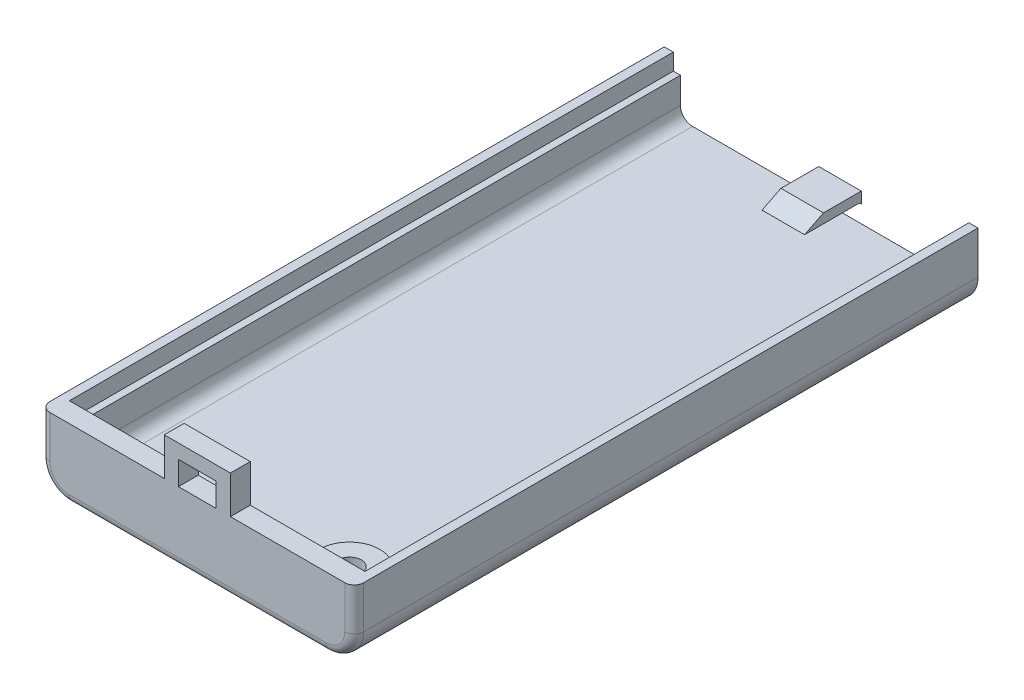
from build123d import *

# Parameters (mm, degrees)
EXTRU_MINCE1_DEPTH             = 32
EXTRU_MINCE1_DEPTH_BACK        = 32
BOSS_EXTRU_1_DEPTH             = 2
BOSS_EXTRU_1_DEPTH_BACK        = 0.1
ESQUISSE2_W                    = 4
ESQUISSE2_H                    = 2.5
ESQUISSE3_W                    = 31.28
ESQUISSE3_H                    = 65.9
ENL_V_MAT_EXTRU_4_DEPTH        = 1.75
ESQUISSE4_W                    = 4.5
ESQUISSE4_H                    = 6
BOSS_EXTRU_2_DEPTH             = 1
BOSS_EXTRU_3_REACH             = 40.572
BOSS_EXTRU_3_DIRECTION_2_REACH = 40.572
ENL_V_MAT_EXTRU_5_REACH        = 41.593
ESQUISSE7_W                    = 6.5
ESQUISSE7_H                    = 0.2
ESQUISSE7_W_2                  = 5.666666666
ESQUISSE7_W_3                  = 4.833333334
ESQUISSE7_W_4                  = 4
EXTRU_MINCE2_DEPTH             = 0.2
ESQUISSE8_R                    = 2.5
ENL_V_MAT_EXTRU_6_DEPTH        = 40.545037615
ESQUISSE9_R                    = 3.2
ESQUISSE9_R_2                  = 1.25
BOSS_EXTRU_4_DEPTH             = 1
CONG_1_R                       = 1


with BuildPart() as part:
    # Esquisse1 → Extru.-Mince1 (new, two sides: drawn at the far end of the back side and taken through both)
    with BuildSketch(Plane.XY.offset(-EXTRU_MINCE1_DEPTH_BACK)):
        with BuildLine():
            Line((-16.6, 0), (-16.6, -4.5))
            ThreePointArc((-16.6, -4.5), (-15.721320344, -6.621320344), (-13.6, -7.5))
            Line((-13.6, -7.5), (13.6, -7.5))
            ThreePointArc((13.6, -7.5), (15.721320344, -6.621320344), (16.6, -4.5))
            Line((16.6, -4.5), (16.6, 0))
            Line((16.6, 0), (14.89, 0))
            Line((14.89, 0), (14.89, -4.5))
            ThreePointArc((14.89, -4.5), (14.512167748, -5.412167748), (13.6, -5.79))
            Line((13.6, -5.79), (-13.6, -5.79))
            ThreePointArc((-13.6, -5.79), (-14.512167748, -5.412167748), (-14.89, -4.5))
            Line((-14.89, -4.5), (-14.89, 0))
            Line((-14.89, 0), (-16.6, 0))
        make_face()
    extrude(amount=EXTRU_MINCE1_DEPTH + EXTRU_MINCE1_DEPTH_BACK)

    # Esquisse2 → Boss.-Extru.1 (add, two sides: drawn at the far end of the back side and taken through both)
    with BuildSketch(Plane.XY.offset(32).offset(-BOSS_EXTRU_1_DEPTH_BACK)):
        with BuildLine():
            Line((16.6, -4.5), (16.6, 0))
            Line((16.6, 0), (3.5, 0))
            Line((3.5, 0), (3.5, 4))
            Line((3.5, 4), (-3.5, 4))
            Line((-3.5, 4), (-3.5, 0))
            Line((-3.5, 0), (-16.6, 0))
            Line((-16.6, 0), (-16.6, -4.5))
            ThreePointArc((-16.6, -4.5), (-15.721320344, -6.621320344), (-13.6, -7.5))
            Line((-13.6, -7.5), (13.6, -7.5))
            ThreePointArc((13.6, -7.5), (15.721320344, -6.621320344), (16.6, -4.5))
        make_face()
        with Locations((0, 1.25)):
            Rectangle(ESQUISSE2_W, ESQUISSE2_H, mode=Mode.SUBTRACT)
    extrude(amount=BOSS_EXTRU_1_DEPTH + BOSS_EXTRU_1_DEPTH_BACK)

    # Esquisse3 → Enlèv. mat.-Extru.4 (cut)
    with BuildSketch(Plane(origin=(0, 0, 0), x_dir=(1, 0, 0), z_dir=(0, 1, 0))):
        with Locations((0, 1.05)):
            Rectangle(ESQUISSE3_W, ESQUISSE3_H)
    extrude(amount=-ENL_V_MAT_EXTRU_4_DEPTH, mode=Mode.SUBTRACT)

    # Esquisse4 → Boss.-Extru.2 (add)
    with BuildSketch(Plane(origin=(0, -5.79, 0), x_dir=(1, 0, 0), z_dir=(0, 1, 0))):
        with Locations((0, 31)):
            Rectangle(ESQUISSE4_W, ESQUISSE4_H)
    extrude(amount=BOSS_EXTRU_2_DEPTH)

    # Boss.-Extru.3: up to this face of the body (flat: up to its plane)
    boss_extru_3_end = Plane(part.part.faces().sort_by_distance((2.25, -5.29, -31))[0])
    # Esquisse5 → Boss.-Extru.3 (add, up to the picked face)
    with BuildSketch(Plane(origin=(0, 0, 0), x_dir=(0, 0, -1), z_dir=(1, 0, 0)), mode=Mode.PRIVATE) as boss_extru_3_sk1:
        Polygon((34, -5.79), (34, -5.99), (33.8, -5.79), align=None)
    boss_extru_3_tool1 = split(extrude(boss_extru_3_sk1.sketch, amount=BOSS_EXTRU_3_REACH, mode=Mode.PRIVATE), bisect_by=boss_extru_3_end, keep=Keep.BOTH, mode=Mode.PRIVATE)
    add(boss_extru_3_tool1.solids().sort_by(Axis((0, -5.856667, -33.933333), (1, 0, 0)))[0])

    # Boss.-Extru.3 direction 2: up to this face of the body (flat: up to its plane)
    boss_extru_3_direction_2_end = Plane(part.part.faces().sort_by_distance((-2.25, -5.29, -31))[0])
    # Esquisse5 → Boss.-Extru.3 direction 2 (add, up to the picked face)
    with BuildSketch(Plane(origin=(0, 0, 0), x_dir=(0, 0, -1), z_dir=(1, 0, 0)), mode=Mode.PRIVATE) as boss_extru_3_direction_2_sk1:
        Polygon((34, -5.79), (34, -5.99), (33.8, -5.79), align=None)
    boss_extru_3_direction_2_tool1 = split(extrude(boss_extru_3_direction_2_sk1.sketch, amount=-BOSS_EXTRU_3_DIRECTION_2_REACH, mode=Mode.PRIVATE), bisect_by=boss_extru_3_direction_2_end, keep=Keep.BOTH, mode=Mode.PRIVATE)
    add(boss_extru_3_direction_2_tool1.solids().sort_by(Axis((0, -5.856667, -33.933333), (-1, 0, 0)))[0])

    # Esquisse6 → Enlèv. mat.-Extru.5 (cut, up to next)
    with BuildSketch(Plane(origin=(2.25, 0, 0), x_dir=(0, 0, -1), z_dir=(1, 0, 0)), mode=Mode.PRIVATE) as enl_v_mat_extru_5_sk1:
        Polygon((28, -5.79), (30, -4.79), (28, -4.79), align=None)
    enl_v_mat_extru_5_tool1 = extrude(enl_v_mat_extru_5_sk1.sketch, amount=-ENL_V_MAT_EXTRU_5_REACH, mode=Mode.PRIVATE) & part.part
    add(enl_v_mat_extru_5_tool1.solids().sort_by_distance((2.25, -5.123333, -28.666667))[0], mode=Mode.SUBTRACT)

    # Esquisse7 → Extru.-Mince2 (add)
    with BuildSketch(Plane.XZ.offset(7.5)):
        with Locations((0, -24.1)):
            Rectangle(ESQUISSE7_W, ESQUISSE7_H)
        with Locations((0, -22.6)):
            Rectangle(ESQUISSE7_W_2, ESQUISSE7_H)
        with Locations((0, -21.1)):
            Rectangle(ESQUISSE7_W_3, ESQUISSE7_H)
        with Locations((0, -19.6)):
            Rectangle(ESQUISSE7_W_4, ESQUISSE7_H)
    extrude(amount=EXTRU_MINCE2_DEPTH)

    # Esquisse8 → Enlèv. mat.-Extru.6 (cut, through all)
    with BuildSketch(Plane.XZ.offset(7.5)):
        with Locations((9.6, 27.5)):
            Circle(ESQUISSE8_R)
    extrude(amount=-ENL_V_MAT_EXTRU_6_DEPTH, mode=Mode.SUBTRACT)

    # Esquisse9 → Boss.-Extru.4 (add)
    with BuildSketch(Plane(origin=(0, -5.79, 0), x_dir=(1, 0, 0), z_dir=(0, 1, 0))):
        with Locations((9.6, -27.5)):
            Circle(ESQUISSE9_R)
        with Locations(Location((9.6, -27.5, 0), (0, 0, 180))):
            Circle(ESQUISSE9_R_2, mode=Mode.SUBTRACT)
    extrude(amount=BOSS_EXTRU_4_DEPTH)

    # Congé1
    cong_1_edges = [part.edges().sort_by_distance(p)[0] for p in [
        (15.721320344, -6.621320344, 34),
        (16.6, -2.25, 34),
        (-16.6, -2.25, 34),
        (-15.721320344, -6.621320344, 34),
        (0, -7.5, 34),
    ]]
    fillet(cong_1_edges, radius=CONG_1_R)


solid = part.part
